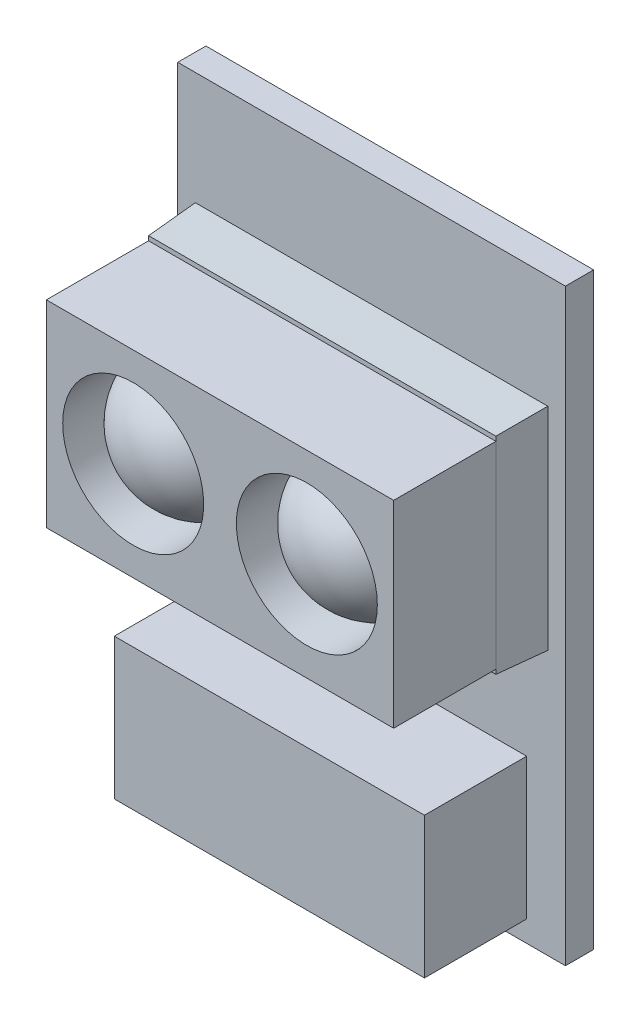
from build123d import *

# Parameters (mm, degrees)
SKETCH1_W           = 11
SKETCH1_H           = 16.7
PCB_DEPTH           = 0.8
SKETCH3_W           = 10
SKETCH3_H           = 6
BOSS_EXTRUDE3_DEPTH = 1.4
BOSS_EXTRUDE3_TAPER = 3
SKETCH4_W           = 9.853258218
SKETCH4_H           = 5.6
BOSS_EXTRUDE4_DEPTH = 2.9
SKETCH5_R           = 2
CUT_EXTRUDE1_DEPTH  = 2
DOME1_FACE_RADIUS   = 2
DOME1_HEIGHT        = 2
DOME2_FACE_RADIUS   = 2
DOME2_HEIGHT        = 2
SKETCH7_W           = 8.8
SKETCH7_H           = 4
BOSS_EXTRUDE5_DEPTH = 2.9
SHELL1_T            = -0.2


with BuildPart() as part:
    # Sketch1 → PCB (new body)
    with BuildSketch(Plane.XY):
        Rectangle(SKETCH1_W, SKETCH1_H)
    extrude(amount=PCB_DEPTH)

    # Sketch3 → Boss-Extrude3 (add)
    with BuildSketch(Plane.XY.offset(0.8)):
        with Locations((0, 2.15)):
            Rectangle(SKETCH3_W, SKETCH3_H)
    extrude(amount=BOSS_EXTRUDE3_DEPTH, taper=BOSS_EXTRUDE3_TAPER)

    # Sketch4 → Boss-Extrude4 (add)
    with BuildSketch(Plane.XY.offset(2.2)):
        with Locations((0, 2.15)):
            Rectangle(SKETCH4_W, SKETCH4_H)
    extrude(amount=BOSS_EXTRUDE4_DEPTH)

    # Sketch5 → Cut-Extrude1 (cut)
    with BuildSketch(Plane.XY.offset(5.1)):
        with Locations((2.463314555, 2.15)):
            Circle(SKETCH5_R)
        with Locations(Location((-2.463314555, 2.15, 0), (0, 0, 180))):
            Circle(SKETCH5_R)
    extrude(amount=-CUT_EXTRUDE1_DEPTH, mode=Mode.SUBTRACT)

    # Dome1: a dome of height H over a round flat face of radius A is a cap of a sphere of radius (A * A + H * H) / (2 * H)
    dome1_r = (DOME1_FACE_RADIUS * DOME1_FACE_RADIUS + DOME1_HEIGHT * DOME1_HEIGHT) / (2 * DOME1_HEIGHT)
    dome1_base = Plane((2.463314555, 2.15, 3.1), z_dir=(0, 0, 1))
    with Locations(dome1_base.offset(DOME1_HEIGHT - dome1_r)):
        dome1_ball = Sphere(dome1_r, mode=Mode.PRIVATE)
    add(split(dome1_ball, bisect_by=dome1_base, keep=Keep.TOP, mode=Mode.PRIVATE))

    # Dome2: a dome of height H over a round flat face of radius A is a cap of a sphere of radius (A * A + H * H) / (2 * H)
    dome2_r = (DOME2_FACE_RADIUS * DOME2_FACE_RADIUS + DOME2_HEIGHT * DOME2_HEIGHT) / (2 * DOME2_HEIGHT)
    dome2_base = Plane((-2.463314555, 2.15, 3.1), z_dir=(0, 0, 1))
    with Locations(dome2_base.offset(DOME2_HEIGHT - dome2_r)):
        dome2_ball = Sphere(dome2_r, mode=Mode.PRIVATE)
    add(split(dome2_ball, bisect_by=dome2_base, keep=Keep.TOP, mode=Mode.PRIVATE))


with BuildPart() as body_2:
    # Sketch7 → Boss-Extrude5 (new body)
    with BuildSketch(Plane.XY.offset(0.8)):
        with Locations((0, -5.75)):
            Rectangle(SKETCH7_W, SKETCH7_H)
    extrude(amount=BOSS_EXTRUDE5_DEPTH)

    # Shell1
    shell1_openings = [body_2.faces().sort_by_distance(p)[0] for p in [
        (0, -7.75, 2.25),
    ]]
    offset(amount=SHELL1_T, openings=shell1_openings, kind=Kind.INTERSECTION)


solid = Compound([part.part, body_2.part])
